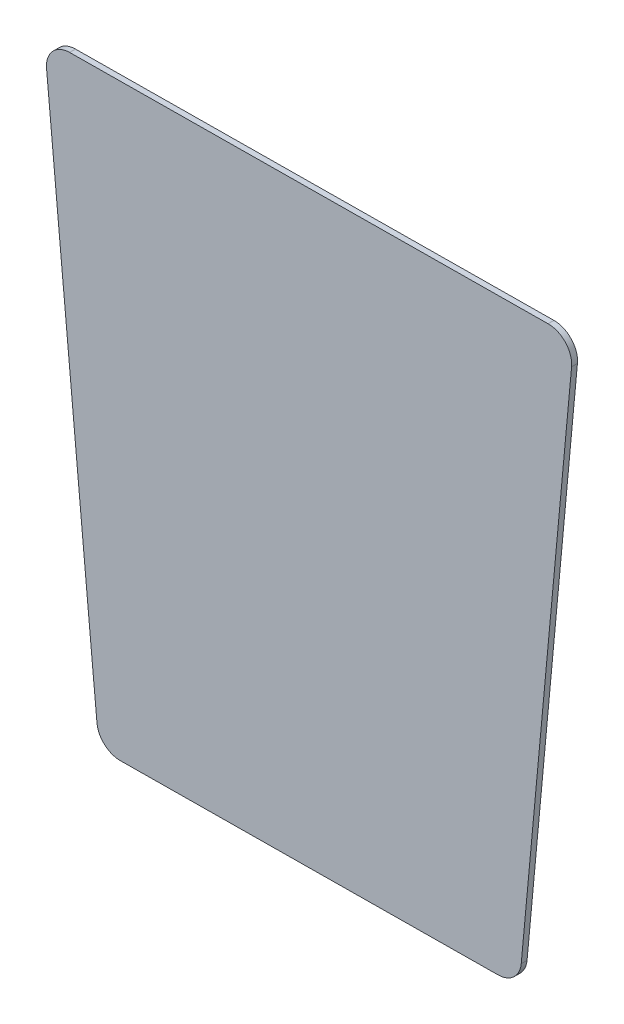
from build123d import *

# Parameters (mm, degrees)
BOSS_EXTRUDE1_DEPTH = 3.175
FILLET1_R           = 12.7


with BuildPart() as part:
    # Sketch1 → Boss-Extrude1 (new body)
    with BuildSketch(Plane.XY.offset(1353.875334154)):
        Polygon((-114.199047439, 112.248526419), (-143.93508403, 431.734038744), (143.93508403, 434.29668119), (114.199047439, 114.267866307), align=None)
    extrude(amount=BOSS_EXTRUDE1_DEPTH)

    # Fillet1
    fillet1_edges = [part.edges().sort_by_distance(p)[0] for p in [
        (-114.199047439, 112.248526419, 1355.462834154),
        (-143.93508403, 431.734038744, 1355.462834154),
        (143.93508403, 434.29668119, 1355.462834154),
        (114.199047439, 114.267866307, 1355.462834154),
    ]]
    fillet(fillet1_edges, radius=FILLET1_R)


solid = part.part
